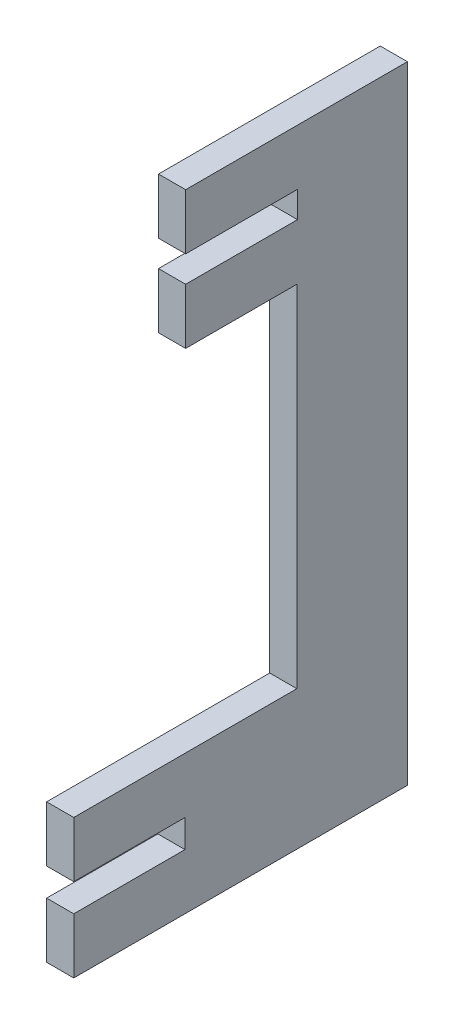
from build123d import *

# Parameters (mm, degrees)
BOSS_EXTRUDE1_DEPTH = 3.0988


with BuildPart() as part:
    # Sketch1 → Boss-Extrude1 (new body)
    with BuildSketch(Plane(origin=(0, 0, 0), x_dir=(0, 0, -1), z_dir=(1, 0, 0))):
        Polygon((-12.7, -1.5875), (-12.7, -7.9375), (25.4, -7.9375), (25.4, 63.637500096), (0.0762, 63.637500096), (0.0762, 57.287500096), (12.8524, 57.287500096), (12.8524, 54.2875), (0.0762, 54.2875), (0.0762, 47.9375), (12.7762, 47.9375), (12.7762, 7.9375), (-12.7, 7.9375), (-12.7, 1.5875), (0, 1.5875), (0, -1.5875), align=None)
    extrude(amount=BOSS_EXTRUDE1_DEPTH)


solid = part.part
